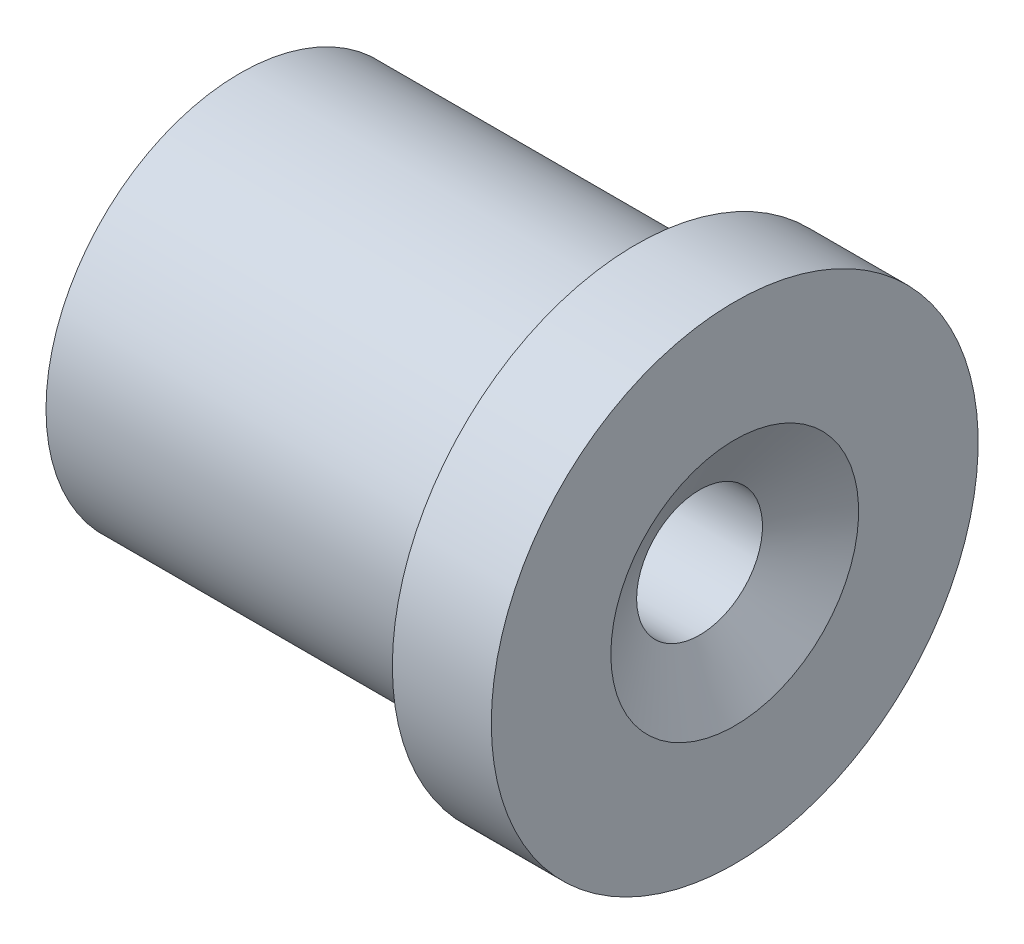
from build123d import *


with BuildPart() as part:
    # Sketch2 → Revolve1 (revolve)
    with BuildSketch(Plane.XY, mode=Mode.PRIVATE) as revolve1_sk:
        Polygon((0, 3.9751), (0, 7.8105), (-3.175, 7.8105), (-3.175, 6.223), (-15.875, 6.223), (-15.875, 4.572), (-15.5194, 4.2164), (-7.1374, 4.2164), (-5.868903724, 2.0193), (-1.129181656, 2.0193), align=None)
    revolve(revolve1_sk.sketch.rotate(Axis((16.596254831, 0, 0), (1, 0, 0)), 90), axis=Axis((16.596254831, 0, 0), (1, 0, 0)))


solid = part.part
